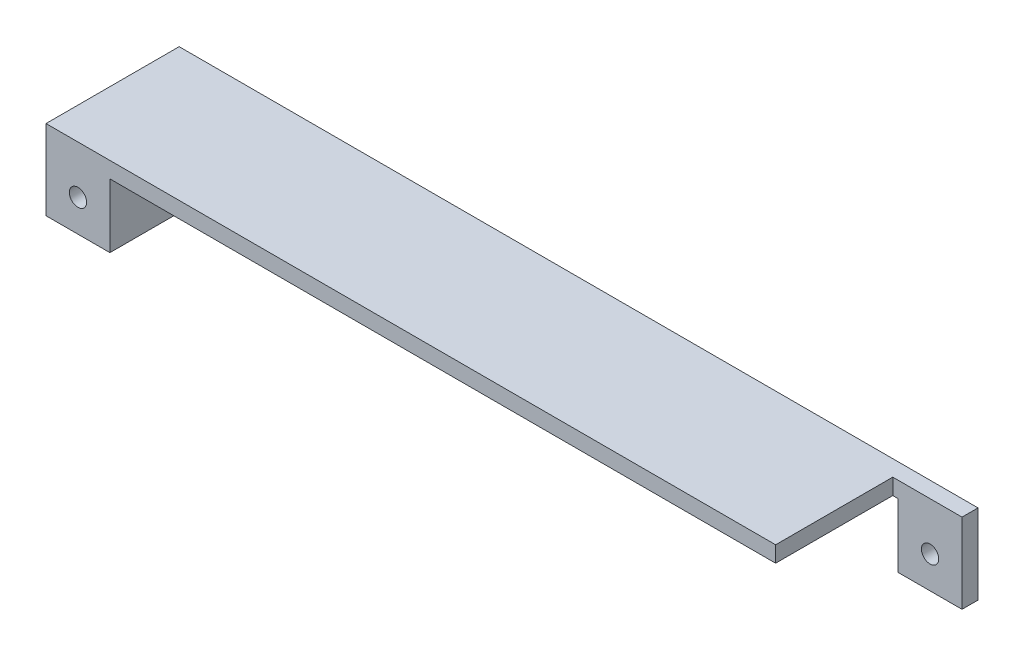
from build123d import *

# Parameters (mm, degrees)
SKETCH1_W           = 150
SKETCH1_H           = 25
BOSS_EXTRUDE1_DEPTH = 3
SKETCH2_W           = 12
SKETCH2_H           = 25
BOSS_EXTRUDE2_DEPTH = 12
SKETCH4_R           = 1.625
CUT_EXTRUDE1_DEPTH  = 153.541797551
SKETCH5_W           = 13
SKETCH5_H           = 22
CUT_EXTRUDE2_DEPTH  = 153.807067899


with BuildPart() as part:
    # Sketch1 → Boss-Extrude1 (new body)
    with BuildSketch(Plane(origin=(0, 0, 0), x_dir=(1, 0, 0), z_dir=(0, 1, 0))):
        with Locations((75, 12.5)):
            Rectangle(SKETCH1_W, SKETCH1_H)
    extrude(amount=BOSS_EXTRUDE1_DEPTH)

    # Sketch2 → Boss-Extrude2 (add)
    with BuildSketch(Plane.XZ):
        with Locations((6, -12.5)):
            Rectangle(SKETCH2_W, SKETCH2_H)
        with Locations((144, -12.5)):
            Rectangle(SKETCH2_W, SKETCH2_H)
    extrude(amount=BOSS_EXTRUDE2_DEPTH)

    # Sketch4 → Cut-Extrude1 (cut, through all)
    with BuildSketch(Plane.XY):
        with Locations((6, -6)):
            Circle(SKETCH4_R)
        with Locations(Location((144, -6, 0), (0, 0, 180))):
            Circle(SKETCH4_R)
    extrude(amount=-CUT_EXTRUDE1_DEPTH, mode=Mode.SUBTRACT)

    # Sketch5 → Cut-Extrude2 (cut, through all)
    with BuildSketch(Plane(origin=(0, 3, 0), x_dir=(1, 0, 0), z_dir=(0, 1, 0))):
        with Locations((143.5, 11)):
            Rectangle(SKETCH5_W, SKETCH5_H)
    extrude(amount=-CUT_EXTRUDE2_DEPTH, mode=Mode.SUBTRACT)


solid = part.part
